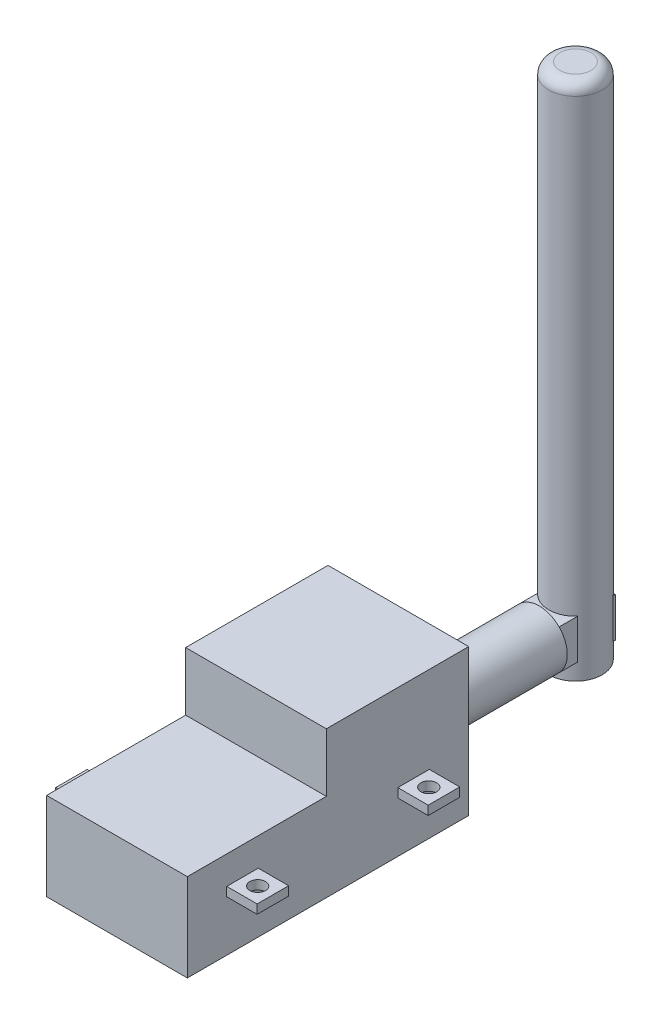
from build123d import *

# Parameters (mm, degrees)
SKETCH_1_W           = 5.4
SKETCH_1_H           = 5.6
SKETCH_1_R           = 1.4
EXTRUDE_1_DEPTH      = 1.6
EXTRUDE_2_DEPTH      = 5
EXTRUDE_3_DEPTH      = 9
SKETCH_5_W           = 25
SKETCH_5_H           = 25.3
EXTRUDE_4_DEPTH      = 10.4
EXTRUDE_5_DEPTH      = 4.43
SKETCH_7_R           = 5
EXTRUDE_6_DEPTH      = 20.58
SKETCH_8_W           = 7.087670288
SKETCH_8_H           = 7.054426262
EXTRUDE_7_DEPTH      = 10
EXTRUDE_8_DEPTH      = 82
EXTRUDE_8_DEPTH_BACK = 10
FILLET_1_R           = 2


with BuildPart() as part:
    # 草图1 → 凸台-拉伸1 (new body)
    # profile 1 of 12: a face of its own
    with BuildSketch(Plane(origin=(0, 0, 0), x_dir=(1, 0, 0), z_dir=(0, 1, 0))):
        Polygon((0, -25), (0, 25), (-12.5, 25), (-12.5, 18), (-12.5, 12.4), (-12.5, -12.4), (-12.5, -18), (-12.5, -25), align=None)
    # profile 2 of 12: a face of its own
    with BuildSketch(Plane(origin=(0, 0, 0), x_dir=(1, 0, 0), z_dir=(0, 1, 0))):
        Polygon((12.5, 18), (12.5, 25), (0, 25), (0, -25), (12.5, -25), (12.5, -18), (12.5, -12.4), (12.5, 12.4), align=None)
    # profile 3 of 12: a face of its own
    with BuildSketch(Plane(origin=(0, 0, 0), x_dir=(1, 0, 0), z_dir=(0, 1, 0))):
        with Locations((-15.2, -15.2)):
            Rectangle(SKETCH_1_W, SKETCH_1_H)
        with Locations(Location((-15.2, -15.2, 0), (0, 0, 270))):
            Circle(SKETCH_1_R, mode=Mode.SUBTRACT)
    # profile 4 of 12: a face of its own
    with BuildSketch(Plane(origin=(0, 0, 0), x_dir=(1, 0, 0), z_dir=(0, 1, 0))):
        with Locations((-15.2, 15.2)):
            Rectangle(SKETCH_1_W, SKETCH_1_H)
        with Locations(Location((-15.2, 15.2, 0), (0, 0, 270))):
            Circle(SKETCH_1_R, mode=Mode.SUBTRACT)
    # profile 5 of 12: a face of its own
    with BuildSketch(Plane(origin=(0, 0, 0), x_dir=(1, 0, 0), z_dir=(0, 1, 0))):
        with BuildLine():
            Line((14.228210201, 14.192217986), (12.5, 12.4))
            Line((12.5, 12.4), (17.9, 12.4))
            Line((17.9, 12.4), (16.171789799, 14.192217986))
            ThreePointArc((16.171789799, 14.192217986), (15.2, 13.8), (14.228210201, 14.192217986))
        make_face()
    # profile 6 of 12: a face of its own
    with BuildSketch(Plane(origin=(0, 0, 0), x_dir=(1, 0, 0), z_dir=(0, 1, 0))):
        with BuildLine():
            Line((17.9, 18), (12.5, 18))
            Line((12.5, 18), (14.228210201, 16.207782014))
            ThreePointArc((14.228210201, 16.207782014), (15.2, 16.6), (16.171789799, 16.207782014))
            Line((16.171789799, 16.207782014), (17.9, 18))
        make_face()
    # profile 7 of 12: a face of its own
    with BuildSketch(Plane(origin=(0, 0, 0), x_dir=(1, 0, 0), z_dir=(0, 1, 0))):
        with BuildLine():
            Line((17.9, 12.4), (17.9, 18))
            Line((17.9, 18), (16.171789799, 16.207782014))
            ThreePointArc((16.171789799, 16.207782014), (16.488507997, 15.747491681), (16.6, 15.2))
            ThreePointArc((16.6, 15.2), (16.488507997, 14.652508319), (16.171789799, 14.192217986))
            Line((16.171789799, 14.192217986), (17.9, 12.4))
        make_face()
    # profile 8 of 12: a face of its own
    with BuildSketch(Plane(origin=(0, 0, 0), x_dir=(1, 0, 0), z_dir=(0, 1, 0))):
        with BuildLine():
            Line((14.228210201, 16.207782014), (12.5, 18))
            Line((12.5, 18), (12.5, 12.4))
            Line((12.5, 12.4), (14.228210201, 14.192217986))
            ThreePointArc((14.228210201, 14.192217986), (13.8, 15.2), (14.228210201, 16.207782014))
        make_face()
    # profile 9 of 12: a face of its own
    with BuildSketch(Plane(origin=(0, 0, 0), x_dir=(1, 0, 0), z_dir=(0, 1, 0))):
        with BuildLine():
            Line((17.9, -12.4), (12.5, -12.4))
            Line((12.5, -12.4), (14.228210201, -14.192217986))
            ThreePointArc((14.228210201, -14.192217986), (15.2, -13.8), (16.171789799, -14.192217986))
            Line((16.171789799, -14.192217986), (17.9, -12.4))
        make_face()
    # profile 10 of 12: a face of its own
    with BuildSketch(Plane(origin=(0, 0, 0), x_dir=(1, 0, 0), z_dir=(0, 1, 0))):
        with BuildLine():
            Line((14.228210201, -14.192217986), (12.5, -12.4))
            Line((12.5, -12.4), (12.5, -18))
            Line((12.5, -18), (14.228210201, -16.207782014))
            ThreePointArc((14.228210201, -16.207782014), (13.8, -15.2), (14.228210201, -14.192217986))
        make_face()
    # profile 11 of 12: a face of its own
    with BuildSketch(Plane(origin=(0, 0, 0), x_dir=(1, 0, 0), z_dir=(0, 1, 0))):
        with BuildLine():
            Line((17.9, -18), (17.9, -12.4))
            Line((17.9, -12.4), (16.171789799, -14.192217986))
            ThreePointArc((16.171789799, -14.192217986), (16.488507997, -14.652508319), (16.6, -15.2))
            ThreePointArc((16.6, -15.2), (16.488507997, -15.747491681), (16.171789799, -16.207782014))
            Line((16.171789799, -16.207782014), (17.9, -18))
        make_face()
    # profile 12 of 12: a face of its own
    with BuildSketch(Plane(origin=(0, 0, 0), x_dir=(1, 0, 0), z_dir=(0, 1, 0))):
        with BuildLine():
            Line((14.228210201, -16.207782014), (12.5, -18))
            Line((12.5, -18), (17.9, -18))
            Line((17.9, -18), (16.171789799, -16.207782014))
            ThreePointArc((16.171789799, -16.207782014), (15.2, -16.6), (14.228210201, -16.207782014))
        make_face()
    extrude(amount=EXTRUDE_1_DEPTH)

    # 草图3 → 凸台-拉伸2 (add)
    with BuildSketch(Plane(origin=(0, 1.6, 0), x_dir=(1, 0, 0), z_dir=(0, 1, 0))):
        Polygon((12.5, 25), (-12.5, 25), (-12.5, 18), (-12.5, 12.4), (-12.5, -12.4), (-12.5, -18), (-12.5, -25), (12.5, -25), (12.5, -18), (12.5, -12.4), (12.5, 12.4), (12.5, 18), align=None)
    extrude(amount=EXTRUDE_2_DEPTH)

    # 草图4 → 凸台-拉伸3 (add)
    with BuildSketch(Plane.XZ):
        Polygon((12.5, 25), (-12.5, 25), (-12.5, 18), (-12.5, 12.4), (-12.5, -12.4), (-12.5, -18), (-12.5, -25), (12.5, -25), (12.5, -18), (12.5, -12.4), (12.5, 12.4), (12.5, 18), align=None)
    extrude(amount=EXTRUDE_3_DEPTH)

    # 草图5 → 凸台-拉伸4 (add)
    with BuildSketch(Plane(origin=(0, 6.6, 0), x_dir=(1, 0, 0), z_dir=(0, 1, 0))):
        with Locations((0, 12.35)):
            Rectangle(SKETCH_5_W, SKETCH_5_H)
    extrude(amount=EXTRUDE_4_DEPTH)

    # 草图6 → 凸台-拉伸5 (add)
    with BuildSketch(Plane(origin=(0, 0, -25), x_dir=(-1, 0, 0), z_dir=(0, 0, -1))):
        with BuildLine():
            ThreePointArc((0, 2.18), (-2.665, -0.485), (0, -3.15))
            Line((0, -3.15), (0, 2.18))
        make_face()
        with BuildLine():
            Line((0, 2.18), (0, -3.15))
            ThreePointArc((0, -3.15), (1.884439572, -2.369439572), (2.665, -0.485))
            ThreePointArc((2.665, -0.485), (1.884439572, 1.399439572), (0, 2.18))
        make_face()
    extrude(amount=EXTRUDE_5_DEPTH)

    # 草图7 → 凸台-拉伸6 (add)
    with BuildSketch(Plane(origin=(0, 0, -29.43), x_dir=(-1, 0, 0), z_dir=(0, 0, -1))):
        with Locations((0, -0.485)):
            Circle(SKETCH_7_R)
    extrude(amount=EXTRUDE_6_DEPTH)

    # 草图8 → 凸台-拉伸7 (add)
    with BuildSketch(Plane(origin=(0, 0, -50.01), x_dir=(-1, 0, 0), z_dir=(0, 0, -1))):
        with Locations((0, -0.485)):
            Rectangle(SKETCH_8_W, SKETCH_8_H)
    extrude(amount=EXTRUDE_7_DEPTH)

    # 草图9 → 凸台-拉伸8 (add, two sides: drawn at the far end of the back side and taken through both)
    with BuildSketch(Plane(origin=(0, 3.042213131, 0), x_dir=(1, 0, 0), z_dir=(0, 1, 0)).offset(-EXTRUDE_8_DEPTH_BACK)):
        with BuildLine():
            Line((3.543835144, 59.627867761), (3.543835144, 53.302132239))
            ThreePointArc((3.543835144, 53.302132239), (4.438226951, 54.772474806), (4.75, 56.465))
            ThreePointArc((4.75, 56.465), (4.438226951, 58.157525194), (3.543835144, 59.627867761))
        make_face()
        with BuildLine():
            ThreePointArc((3.161562114, 60.01), (0, 61.215), (-3.161562114, 60.01))
            Line((-3.161562114, 60.01), (3.161562114, 60.01))
        make_face()
        with BuildLine():
            Line((-3.543835144, 53.302132239), (-3.543835144, 59.627867761))
            ThreePointArc((-3.543835144, 59.627867761), (-4.75, 56.465), (-3.543835144, 53.302132239))
        make_face()
        with BuildLine():
            ThreePointArc((-3.161562114, 52.92), (0, 51.715), (3.161562114, 52.92))
            Line((3.161562114, 52.92), (-3.161562114, 52.92))
        make_face()
        with BuildLine():
            Line((3.358205246, 53.105690915), (0, 56.465))
            Line((0, 56.465), (-3.358205246, 53.105690915))
            ThreePointArc((-3.358205246, 53.105690915), (-3.261205588, 53.011445582), (-3.161562114, 52.92))
            Line((-3.161562114, 52.92), (3.161562114, 52.92))
            ThreePointArc((3.161562114, 52.92), (3.261205588, 53.011445582), (3.358205246, 53.105690915))
        make_face()
        with BuildLine():
            Line((0, 56.465), (-3.358205246, 59.824309085))
            ThreePointArc((-3.358205246, 59.824309085), (-3.452417658, 59.727408974), (-3.543835144, 59.627867761))
            Line((-3.543835144, 59.627867761), (-3.543835144, 53.302132239))
            ThreePointArc((-3.543835144, 53.302132239), (-3.452417658, 53.202591026), (-3.358205246, 53.105690915))
            Line((-3.358205246, 53.105690915), (0, 56.465))
        make_face()
        with BuildLine():
            ThreePointArc((-3.161562114, 60.01), (-3.261205588, 59.918554418), (-3.358205246, 59.824309085))
            Line((-3.358205246, 59.824309085), (0, 56.465))
            Line((0, 56.465), (3.358205246, 59.824309085))
            ThreePointArc((3.358205246, 59.824309085), (3.261205588, 59.918554418), (3.161562114, 60.01))
            Line((3.161562114, 60.01), (-3.161562114, 60.01))
        make_face()
        with BuildLine():
            Line((3.358205246, 59.824309085), (0, 56.465))
            Line((0, 56.465), (3.358205246, 53.105690915))
            ThreePointArc((3.358205246, 53.105690915), (3.452417658, 53.202591026), (3.543835144, 53.302132239))
            Line((3.543835144, 53.302132239), (3.543835144, 59.627867761))
            ThreePointArc((3.543835144, 59.627867761), (3.452417658, 59.727408974), (3.358205246, 59.824309085))
        make_face()
    extrude(amount=EXTRUDE_8_DEPTH + EXTRUDE_8_DEPTH_BACK)

    # 圆角1
    fillet_1_edges = [part.edges().sort_by_distance(p)[0] for p in [
        (-3.359309085, 85.042213131, -53.106794754),
    ]]
    fillet(fillet_1_edges, radius=FILLET_1_R)


solid = part.part
